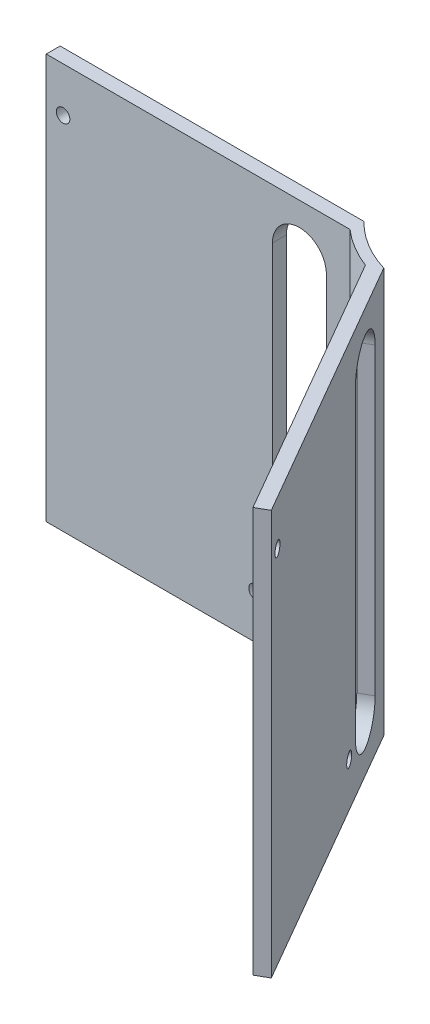
from build123d import *

# Parameters (mm, degrees)
BOSS_EXTRU_1_DEPTH      = 120
ENL_V_MAT_EXTRU_1_DEPTH = 188.009777727
ENL_V_MAT_EXTRU_2_DEPTH = 180.784310366
ESQUISSE6_R             = 2
ENL_V_MAT_EXTRU_3_DEPTH = 188.009777727
ESQUISSE7_R             = 2
ENL_V_MAT_EXTRU_4_DEPTH = 180.784310366
ESQUISSE8_R             = 2
ENL_V_MAT_EXTRU_5_DEPTH = 188.009777727
ESQUISSE9_R             = 2
ENL_V_MAT_EXTRU_6_DEPTH = 180.784310366


with BuildPart() as part:
    # Esquisse3 → Boss.-Extru.1 (new body)
    with BuildSketch(Plane(origin=(0, 0, 0), x_dir=(1, 0, 0), z_dir=(0, 1, 0))):
        with BuildLine():
            ThreePointArc((-10.103808925, -33.509894736), (-18.121448463, -29.943498553), (-25, -24.494897428))
            Line((-25, -24.494897428), (-115, -24.494897428))
            Line((-115, -24.494897428), (-115, -28.618176043))
            Line((-115, -28.618176043), (-25, -28.618176043))
            ThreePointArc((-25, -28.618176043), (-19.581111, -32.566548666), (-13.552631037, -35.50107311))
            Line((-13.552631037, -35.50107311), (31.963111135, -114.336651096))
            Line((31.963111135, -114.336651096), (35.411933246, -112.345472721))
            Line((35.411933246, -112.345472721), (-10.103808925, -33.509894736))
        make_face()
    extrude(amount=BOSS_EXTRU_1_DEPTH)

    # Esquisse4 → Enlèv. mat.-Extru.1 (cut, through all)
    with BuildSketch(Plane.XY.offset(28.618176043)):
        with BuildLine():
            Line((-48, 105), (-48, 15))
            ThreePointArc((-48, 15), (-40, 7), (-32, 15))
            Line((-32, 15), (-32, 105))
            ThreePointArc((-32, 105), (-40, 113), (-48, 105))
        make_face()
    extrude(amount=-ENL_V_MAT_EXTRU_1_DEPTH, mode=Mode.SUBTRACT)

    # Esquisse5 → Enlèv. mat.-Extru.2 (cut, through all)
    with BuildSketch(Plane(origin=(-25.536888865, 0, 14.743729661), x_dir=(0.4999999999999999, 0, 0.8660254037844386), z_dir=(-0.8660254037844387, 0, 0.49999999999999994))):
        with BuildLine():
            Line((46.968515657, 105), (46.968515657, 15))
            ThreePointArc((46.968515657, 15), (38.968515657, 7), (30.968515657, 15))
            Line((30.968515657, 15), (30.968515657, 105))
            ThreePointArc((30.968515657, 105), (38.968515657, 113), (46.968515657, 105))
        make_face()
    extrude(amount=-ENL_V_MAT_EXTRU_2_DEPTH, mode=Mode.SUBTRACT)

    # Esquisse6 → Enlèv. mat.-Extru.3 (cut, through all)
    with BuildSketch(Plane.XY.offset(28.618176043)):
        with Locations((-110, 106.75)):
            Circle(ESQUISSE6_R)
    extrude(amount=-ENL_V_MAT_EXTRU_3_DEPTH, mode=Mode.SUBTRACT)

    # Esquisse7 → Enlèv. mat.-Extru.4 (cut, through all)
    with BuildSketch(Plane(origin=(-25.536888865, 0, 14.743729661), x_dir=(0.4999999999999999, 0, 0.8660254037844386), z_dir=(-0.8660254037844387, 0, 0.49999999999999994))):
        with Locations((110, 106.75)):
            Circle(ESQUISSE7_R)
    extrude(amount=-ENL_V_MAT_EXTRU_4_DEPTH, mode=Mode.SUBTRACT)

    # Esquisse8 → Enlèv. mat.-Extru.5 (cut, through all)
    with BuildSketch(Plane.XY.offset(28.618176043)):
        with Locations((-53, 13)):
            Circle(ESQUISSE8_R)
    extrude(amount=-ENL_V_MAT_EXTRU_5_DEPTH, mode=Mode.SUBTRACT)

    # Esquisse9 → Enlèv. mat.-Extru.6 (cut, through all)
    with BuildSketch(Plane(origin=(-25.536888865, 0, 14.743729661), x_dir=(0.4999999999999999, 0, 0.8660254037844386), z_dir=(-0.8660254037844387, 0, 0.49999999999999994))):
        with Locations((51.968515657, 13)):
            Circle(ESQUISSE9_R)
    extrude(amount=-ENL_V_MAT_EXTRU_6_DEPTH, mode=Mode.SUBTRACT)


solid = part.part
